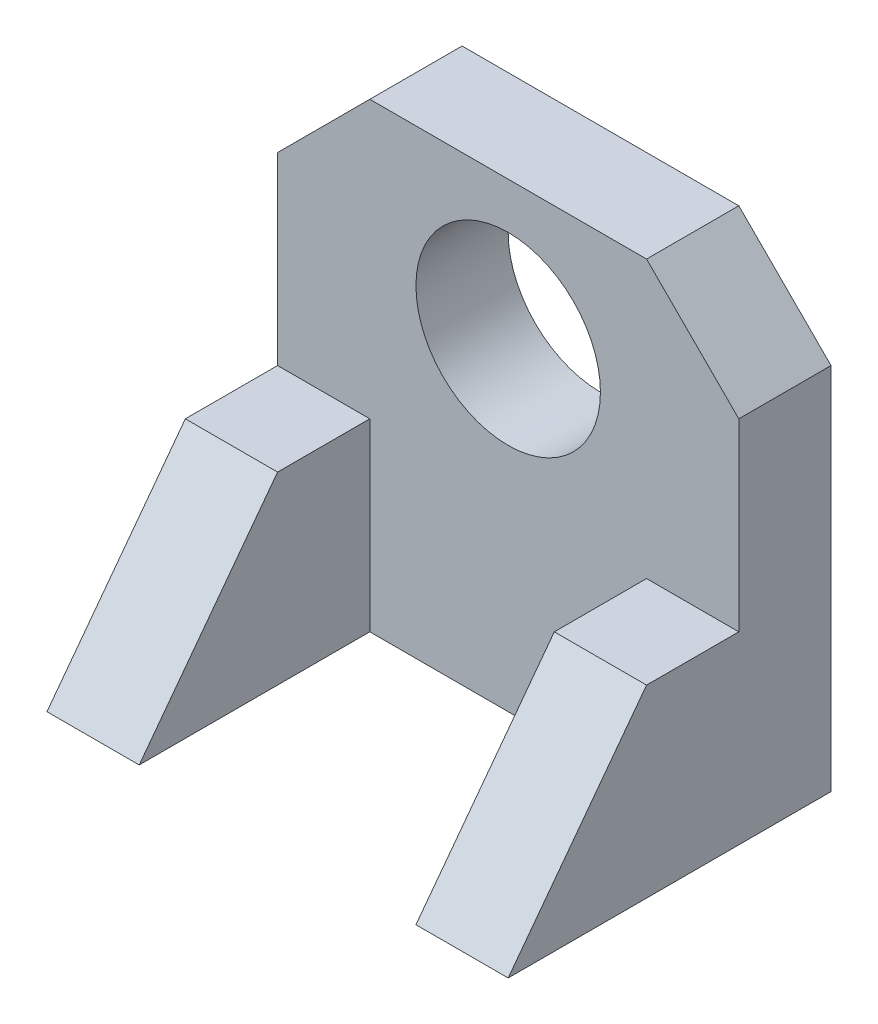
from build123d import *

# Parameters (mm, degrees)
SKETCH1_R           = 10
BOSS_EXTRUDE1_DEPTH = 10
BOSS_EXTRUDE2_START = 15
BOSS_EXTRUDE2_DEPTH = 10


with BuildPart() as part:
    # Sketch1 → Boss-Extrude1 (new body)
    with BuildSketch(Plane.XY):
        Polygon((-25, 0), (25, 0), (25, 40), (15, 50), (-15, 50), (-25, 40), align=None)
        with Locations((0, 35)):
            Circle(SKETCH1_R, mode=Mode.SUBTRACT)
    extrude(amount=BOSS_EXTRUDE1_DEPTH)

    # Sketch2 → Boss-Extrude2 (add)
    with BuildSketch(Plane(origin=(0, 0, 0), x_dir=(0, 0, -1), z_dir=(1, 0, 0)).offset(BOSS_EXTRUDE2_START)):
        Polygon((-10, 20), (-20, 20), (-35, 0), (-10, 0), align=None)
    boss_extrude2 = extrude(amount=BOSS_EXTRUDE2_DEPTH)

    # Mirror1: Boss-Extrude2 across plane
    add(boss_extrude2.mirror(Plane(origin=(0, 0, 0), x_dir=(0, 0, 1), z_dir=(1, 0, 0))))


solid = part.part
